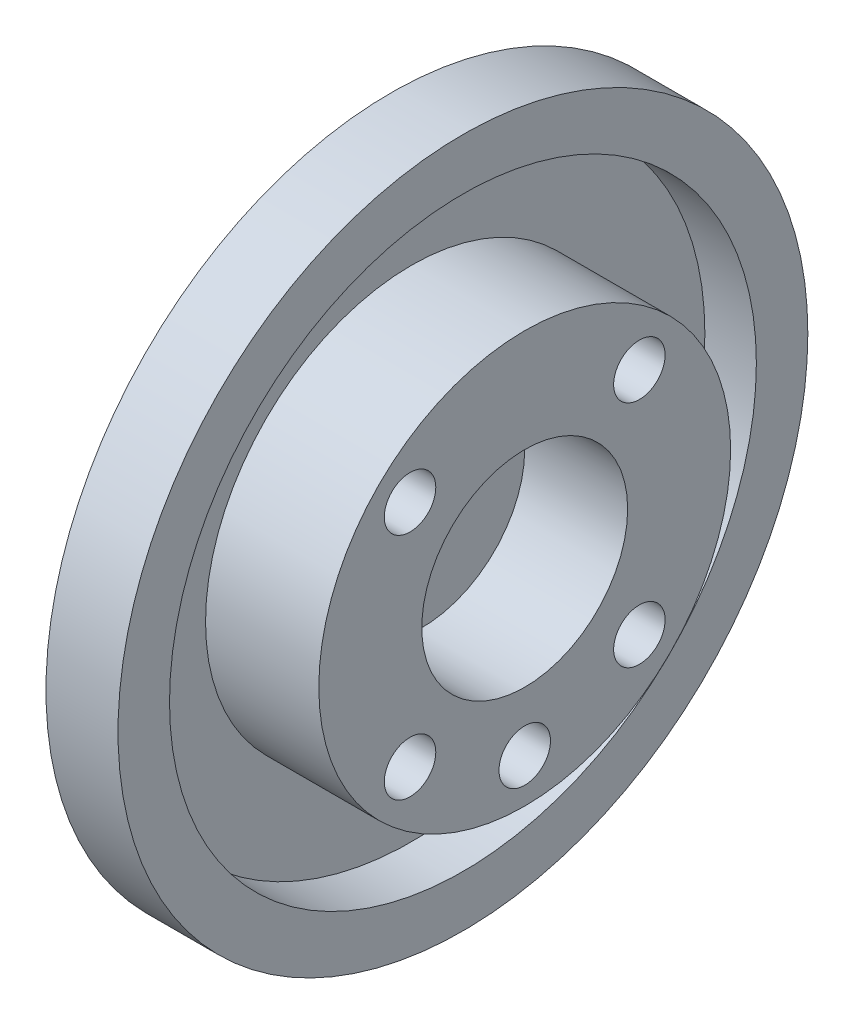
from build123d import *

# Parameters (mm, degrees)
SKETCH_1_R          = 33.5
EXTRUDE_1_DEPTH     = 7
SKETCH_3_R          = 28.5
CUT_EXTRUDE_1_DEPTH = 5
SKETCH_4_R          = 2.5
CUT_EXTRUDE_2_DEPTH = 5
SKETCH_5_R          = 20
EXTRUDE_2_DEPTH     = 11
SKETCH_6_R          = 10
CUT_EXTRUDE_5_DEPTH = 10
M5X0_8_1_AT_2_COUNT = 2
M5X0_8_1_AT_2_PITCH = 31.5
M5X0_8_1_AT_3_COUNT = 2
M5X0_8_1_AT_3_PITCH = 22.273863607
M5X0_8_1_AT_4_COUNT = 2
M5X0_8_1_AT_4_PITCH = 22.273863607
SKETCH_7_R          = 2.5
CUT_EXTRUDE_6_DEPTH = 7


with BuildPart() as part:
    # ｽｹｯﾁ1 → 押し出し1 (new body)
    with BuildSketch(Plane(origin=(0, 0, 0), x_dir=(0, 0, -1), z_dir=(1, 0, 0))):
        Circle(SKETCH_1_R)
    extrude(amount=EXTRUDE_1_DEPTH)

    # ｽｹｯﾁ3 → ｶｯﾄ - 押し出し1 (cut)
    with BuildSketch(Plane(origin=(7, 0, 0), x_dir=(0, 0, -1), z_dir=(1, 0, 0))):
        Circle(SKETCH_3_R)
    extrude(amount=-CUT_EXTRUDE_1_DEPTH, mode=Mode.SUBTRACT)

    # ｽｹｯﾁ4 → ｶｯﾄ - 押し出し2 (cut)
    with BuildSketch(Plane(origin=(2, 0, 0), x_dir=(0, 0, -1), z_dir=(1, 0, 0))):
        Circle(SKETCH_4_R)
    extrude(amount=-CUT_EXTRUDE_2_DEPTH, mode=Mode.SUBTRACT)

    # ｽｹｯﾁ5 → 押し出し2 (add)
    with BuildSketch(Plane(origin=(2, 0, 0), x_dir=(0, 0, -1), z_dir=(1, 0, 0))):
        Circle(SKETCH_5_R)
    extrude(amount=EXTRUDE_2_DEPTH)

    # ｽｹｯﾁ6 → ｶｯﾄ - 押し出し5 (cut)
    with BuildSketch(Plane(origin=(13, 0, 0), x_dir=(0, 0, -1), z_dir=(1, 0, 0))):
        Circle(SKETCH_6_R)
    extrude(amount=-CUT_EXTRUDE_5_DEPTH, mode=Mode.SUBTRACT)

    # ｽｹｯﾁ10 → M5x0.8 ねじ穴1 (revolve, cut)
    with BuildSketch(Plane(origin=(13, 11.136931804, 11.136931804), x_dir=(0, 0, -1), z_dir=(0, 1, 0))):
        Polygon((0, 0), (0, 10.2618073), (2.1, 9), (2.1, 10), (2.5, 10), (2.5, 0), align=None)
    m5x0_8_1 = revolve(axis=Axis((19.35, 11.136931804, 11.136931804), (-1, 0, 0)), mode=Mode.SUBTRACT)

    # M5x0.8 ねじ穴1 at 2: M5x0.8 ねじ穴1 ×2
    with Locations(*[Vector(0, -0.7071067811865511, -0.707106781186544) * (i * M5X0_8_1_AT_2_PITCH) for i in range(1, M5X0_8_1_AT_2_COUNT)]):
        add(m5x0_8_1, mode=Mode.SUBTRACT)

    # M5x0.8 ねじ穴1 at 3: M5x0.8 ねじ穴1 ×2
    with Locations(*[(0, -i * M5X0_8_1_AT_3_PITCH, 0) for i in range(1, M5X0_8_1_AT_3_COUNT)]):
        add(m5x0_8_1, mode=Mode.SUBTRACT)

    # M5x0.8 ねじ穴1 at 4: M5x0.8 ねじ穴1 ×2
    with Locations(*[(0, 0, -i * M5X0_8_1_AT_4_PITCH) for i in range(1, M5X0_8_1_AT_4_COUNT)]):
        add(m5x0_8_1, mode=Mode.SUBTRACT)

    # ｽｹｯﾁ7 → ｶｯﾄ - 押し出し6 (cut)
    with BuildSketch(Plane(origin=(13, 0, 0), x_dir=(0, 0, -1), z_dir=(1, 0, 0))):
        with Locations((0, -15.740397433)):
            Circle(SKETCH_7_R)
    extrude(amount=-CUT_EXTRUDE_6_DEPTH, mode=Mode.SUBTRACT)


solid = part.part
